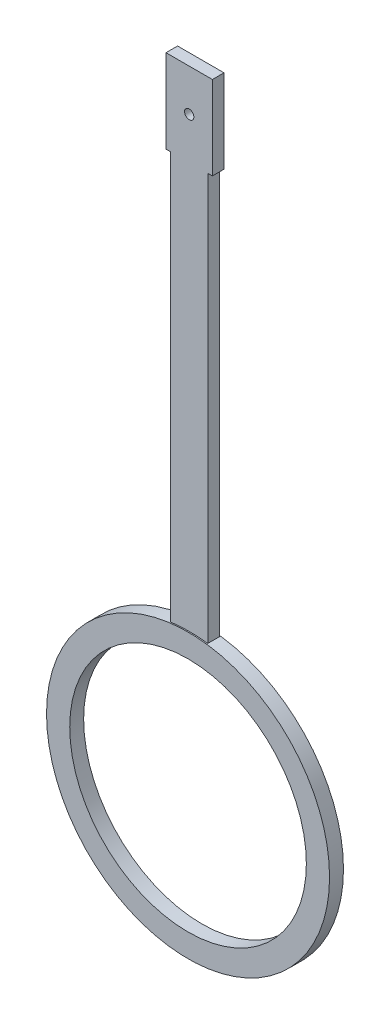
from build123d import *

# Parameters (mm, degrees)
SKETCH1_R           = 30.5
BOSS_EXTRUDE1_DEPTH = 1.5
SKETCH2_W           = 8
SKETCH2_H           = 93
BOSS_EXTRUDE2_DEPTH = 1.25
SKETCH3_W           = 10
SKETCH3_H           = 18
BOSS_EXTRUDE3_DEPTH = 1.25
SKETCH4_R           = 25.5
CUT_EXTRUDE1_DEPTH  = 10
SKETCH5_R           = 1
CUT_EXTRUDE2_DEPTH  = 10


with BuildPart() as part:
    # Sketch1 → Boss-Extrude1 (new, symmetric)
    with BuildSketch(Plane.XY):
        Circle(SKETCH1_R)
    extrude(amount=BOSS_EXTRUDE1_DEPTH, both=True)

    # Sketch2 → Boss-Extrude2 (add, symmetric)
    with BuildSketch(Plane.XY):
        with Locations((0, 71.5)):
            Rectangle(SKETCH2_W, SKETCH2_H)
    extrude(amount=BOSS_EXTRUDE2_DEPTH, both=True)

    # Sketch3 → Boss-Extrude3 (add, symmetric)
    with BuildSketch(Plane.XY):
        with Locations((0, 127)):
            Rectangle(SKETCH3_W, SKETCH3_H)
    extrude(amount=BOSS_EXTRUDE3_DEPTH, both=True)

    # Sketch4 → Cut-Extrude1 (cut, symmetric)
    with BuildSketch(Plane.XY):
        Circle(SKETCH4_R)
    extrude(amount=CUT_EXTRUDE1_DEPTH, both=True, mode=Mode.SUBTRACT)

    # Sketch5 → Cut-Extrude2 (cut, symmetric)
    with BuildSketch(Plane.XY):
        with Locations((0, 127)):
            Circle(SKETCH5_R)
    extrude(amount=CUT_EXTRUDE2_DEPTH, both=True, mode=Mode.SUBTRACT)


solid = part.part
